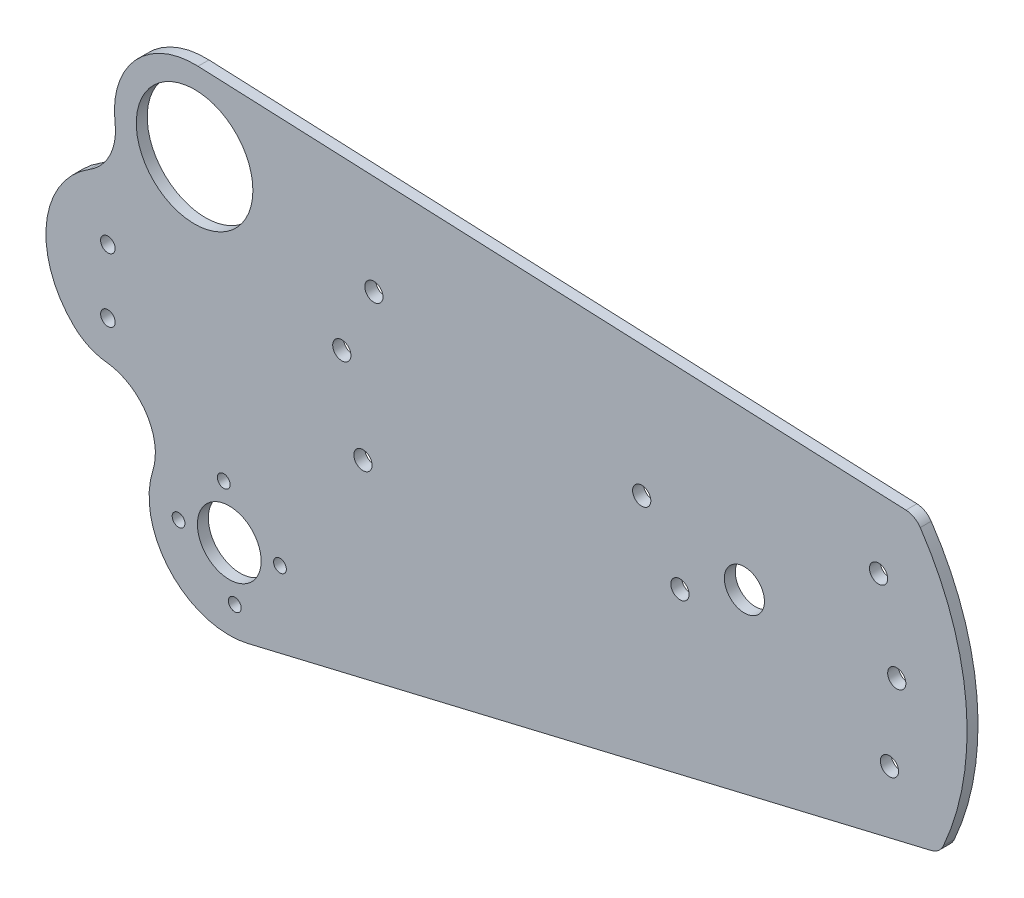
from build123d import *

# Parameters (mm, degrees)
SKETCH1_R           = 2
SKETCH1_R_2         = 2.5
SKETCH1_R_3         = 16
SKETCH1_R_4         = 5.5
SKETCH1_R_5         = 1.75
SKETCH1_R_6         = 8.75
BOSS_EXTRUDE1_DEPTH = 3


with BuildPart() as part:
    # Sketch1 → Boss-Extrude1 (new body)
    with BuildSketch(Plane.XY):
        with BuildLine():
            ThreePointArc((-113.560266524, 49.479735972), (-130.694234864, 42.395842918), (-136.329525131, 24.732380193))
            ThreePointArc((-136.329525131, 24.732380193), (-137.686520221, 16.356467092), (-143.370984404, 10.056925608))
            ThreePointArc((-143.370984404, 10.056925608), (-155.166532009, -8.626129333), (-147.542861296, -29.364285714))
            ThreePointArc((-147.542861296, -29.364285714), (-143.475887893, -32.124161339), (-138.735140925, -33.421275181))
            ThreePointArc((-138.735140925, -33.421275181), (-127.733357788, -40.106373668), (-125.965715234, -52.858048609))
            ThreePointArc((-125.965715234, -52.858048609), (-121.095745986, -74.463536322), (-99.899442585, -80.88462828))
            Line((-99.899442585, -80.88462828), (87.590338172, -36.326384859))
            ThreePointArc((87.590338172, -36.326384859), (89.625170423, -35.311295666), (91, -33.5))
            ThreePointArc((91, -33.5), (97.213976906, 3.543991621), (84.648444567, 38.941424032))
            ThreePointArc((84.648444567, 38.941424032), (82.945648013, 40.504860181), (80.721588123, 41.135261877))
            Line((80.721588123, 41.135261877), (-113.560266524, 49.479735972))
        make_face()
        with Locations((-138.3, -22.75)):
            Circle(SKETCH1_R, mode=Mode.SUBTRACT)
        with Locations((-68.3, -21.5)):
            Circle(SKETCH1_R_2, mode=Mode.SUBTRACT)
        with Locations((76.2, -22)):
            Circle(SKETCH1_R_2, mode=Mode.SUBTRACT)
        with Locations((-138.3, -5.25)):
            Circle(SKETCH1_R, mode=Mode.SUBTRACT)
        with Locations((-74.1, 1.7)):
            Circle(SKETCH1_R_2, mode=Mode.SUBTRACT)
        with Locations((-114.504303927, 27.5)):
            Circle(SKETCH1_R_3, mode=Mode.SUBTRACT)
        with Locations((-65.3, 20)):
            Circle(SKETCH1_R_2, mode=Mode.SUBTRACT)
        with Locations((18.7, -8.7)):
            Circle(SKETCH1_R_2, mode=Mode.SUBTRACT)
        with Locations((8.2, 8.3)):
            Circle(SKETCH1_R_2, mode=Mode.SUBTRACT)
        with Locations((36.382449965, 0)):
            Circle(SKETCH1_R_4, mode=Mode.SUBTRACT)
        with Locations((78.2, -0.1)):
            Circle(SKETCH1_R_2, mode=Mode.SUBTRACT)
        with Locations((73.2, 22.3)):
            Circle(SKETCH1_R_2, mode=Mode.SUBTRACT)
        with Locations((-106.509109084, -45.563854671)):
            Circle(SKETCH1_R_5, mode=Mode.SUBTRACT)
        with Locations((-103.463320573, -73.39770407)):
            Circle(SKETCH1_R_5, mode=Mode.SUBTRACT)
        with Locations((-118.903139528, -61.003673626)):
            Circle(SKETCH1_R_5, mode=Mode.SUBTRACT)
        with Locations((-104.986214828, -59.480779371)):
            Circle(SKETCH1_R_6, mode=Mode.SUBTRACT)
        with Locations((-91.069290129, -57.957885115)):
            Circle(SKETCH1_R_5, mode=Mode.SUBTRACT)
    extrude(amount=BOSS_EXTRUDE1_DEPTH)


solid = part.part
